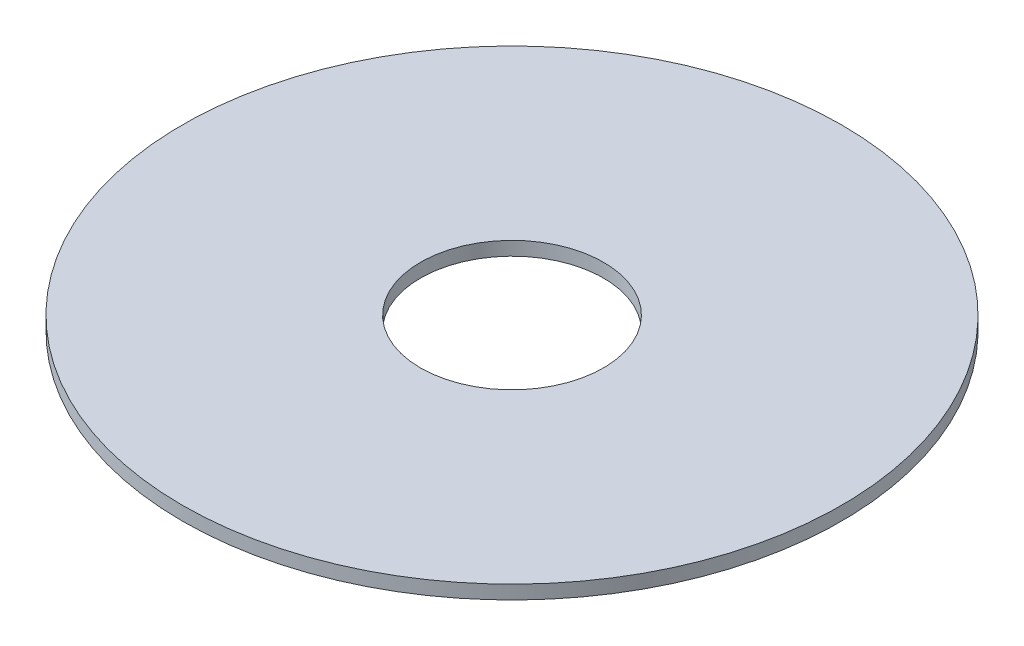
from build123d import *

# Parameters (mm, degrees)
SKETCH2_R           = 18
SKETCH2_R_2         = 5
BOSS_EXTRUDE1_DEPTH = 0.75


with BuildPart() as part:
    # Sketch2 → Boss-Extrude1 (new body)
    with BuildSketch(Plane(origin=(0, 0, 0), x_dir=(1, 0, 0), z_dir=(0, 1, 0))):
        with Locations(Location((0, 0, 0), (0, 0, 270))):
            Circle(SKETCH2_R)
        with Locations(Location((0, 0, 0), (0, 0, 270))):
            Circle(SKETCH2_R_2, mode=Mode.SUBTRACT)
    extrude(amount=BOSS_EXTRUDE1_DEPTH)


solid = part.part
